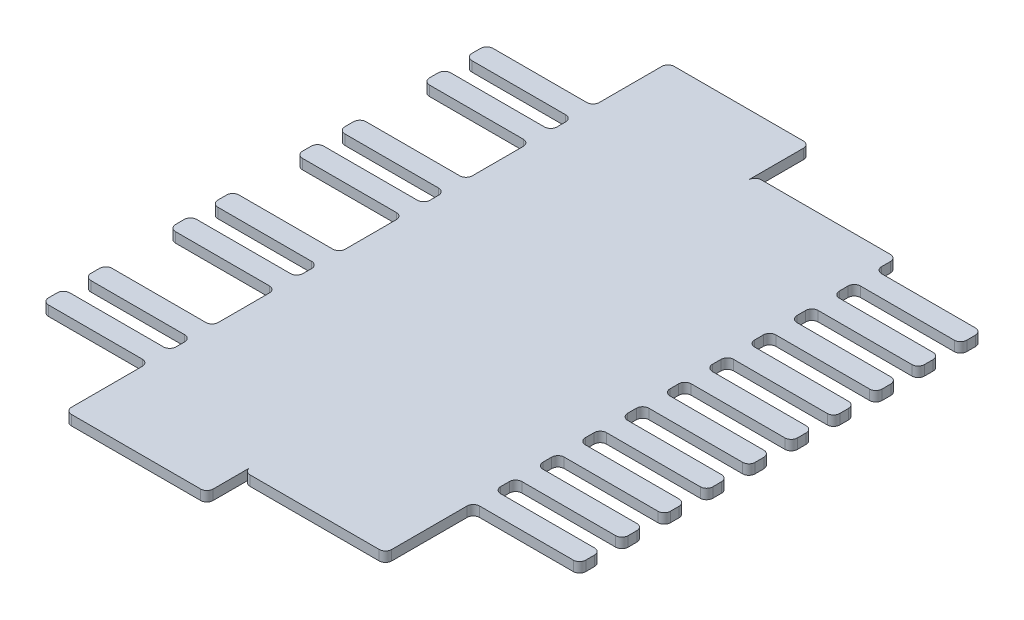
from build123d import *

# Parameters (mm, degrees)
BOSS_EXTRUDE1_DEPTH = 1.2


with BuildPart() as part:
    # Sketch1 → Boss-Extrude1 (new body)
    with BuildSketch(Plane(origin=(0, 0, 0), x_dir=(1, 0, 0), z_dir=(0, 1, 0))):
        with BuildLine():
            Line((-0.75, 10), (-12, 10))
            ThreePointArc((-12, 10), (-12.530330086, 10.219669914), (-12.75, 10.75))
            Line((-12.75, 10.75), (-12.75, 11.79))
            ThreePointArc((-12.75, 11.79), (-12.530330086, 12.320330086), (-12, 12.54))
            Line((-12, 12.54), (-0.75, 12.54))
            ThreePointArc((-0.75, 12.54), (-0.219669914, 12.759669914), (0, 13.29))
            Line((0, 13.29), (0, 14.33))
            ThreePointArc((0, 14.33), (-0.219669914, 14.860330086), (-0.75, 15.08))
            Line((-0.75, 15.08), (-12, 15.08))
            ThreePointArc((-12, 15.08), (-12.530330086, 15.299669914), (-12.75, 15.83))
            Line((-12.75, 15.83), (-12.75, 16.87))
            ThreePointArc((-12.75, 16.87), (-12.530330086, 17.400330086), (-12, 17.62))
            Line((-12, 17.62), (-0.75, 17.62))
            ThreePointArc((-0.75, 17.62), (-0.219669914, 17.839669914), (0, 18.37))
            Line((0, 18.37), (0, 24.49))
            ThreePointArc((0, 24.49), (-0.219669914, 25.020330086), (-0.75, 25.24))
            Line((-0.75, 25.24), (-12, 25.24))
            ThreePointArc((-12, 25.24), (-12.530330086, 25.459669914), (-12.75, 25.99))
            Line((-12.75, 25.99), (-12.75, 27.03))
            ThreePointArc((-12.75, 27.03), (-12.530330086, 27.560330086), (-12, 27.78))
            Line((-12, 27.78), (-0.75, 27.78))
            ThreePointArc((-0.75, 27.78), (-0.219669914, 27.999669914), (0, 28.53))
            Line((0, 28.53), (0, 29.57))
            ThreePointArc((0, 29.57), (-0.219669914, 30.100330086), (-0.75, 30.32))
            Line((-0.75, 30.32), (-12, 30.32))
            ThreePointArc((-12, 30.32), (-12.530330086, 30.539669914), (-12.75, 31.07))
            Line((-12.75, 31.07), (-12.75, 32.11))
            ThreePointArc((-12.75, 32.11), (-12.530330086, 32.640330086), (-12, 32.86))
            Line((-12, 32.86), (-0.75, 32.86))
            ThreePointArc((-0.75, 32.86), (-0.219669914, 33.079669914), (0, 33.61))
            Line((0, 33.61), (0, 39.73))
            ThreePointArc((0, 39.73), (-0.219669914, 40.260330086), (-0.75, 40.48))
            Line((-0.75, 40.48), (-12, 40.48))
            ThreePointArc((-12, 40.48), (-12.530330086, 40.699669914), (-12.75, 41.23))
            Line((-12.75, 41.23), (-12.75, 42.27))
            ThreePointArc((-12.75, 42.27), (-12.530330086, 42.800330086), (-12, 43.02))
            Line((-12, 43.02), (-0.75, 43.02))
            ThreePointArc((-0.75, 43.02), (-0.219669914, 43.239669914), (0, 43.77))
            Line((0, 43.77), (0, 44.81))
            ThreePointArc((0, 44.81), (-0.219669914, 45.340330086), (-0.75, 45.56))
            Line((-0.75, 45.56), (-12, 45.56))
            ThreePointArc((-12, 45.56), (-12.530330086, 45.779669914), (-12.75, 46.31))
            Line((-12.75, 46.31), (-12.75, 47.35))
            ThreePointArc((-12.75, 47.35), (-12.530330086, 47.880330086), (-12, 48.1))
            Line((-12, 48.1), (-0.75, 48.1))
            ThreePointArc((-0.75, 48.1), (-0.219669914, 48.319669914), (0, 48.85))
            Line((0, 48.85), (0, 54.97))
            ThreePointArc((0, 54.97), (-0.219669914, 55.500330086), (-0.75, 55.72))
            Line((-0.75, 55.72), (-12, 55.72))
            ThreePointArc((-12, 55.72), (-12.530330086, 55.939669914), (-12.75, 56.47))
            Line((-12.75, 56.47), (-12.75, 57.51))
            ThreePointArc((-12.75, 57.51), (-12.530330086, 58.040330086), (-12, 58.26))
            Line((-12, 58.26), (-0.75, 58.26))
            ThreePointArc((-0.75, 58.26), (-0.219669914, 58.479669914), (0, 59.01))
            Line((0, 59.01), (0, 60.05))
            ThreePointArc((0, 60.05), (-0.219669914, 60.580330086), (-0.75, 60.8))
            Line((-0.75, 60.8), (-12, 60.8))
            ThreePointArc((-12, 60.8), (-12.530330086, 61.019669914), (-12.75, 61.55))
            Line((-12.75, 61.55), (-12.75, 62.59))
            ThreePointArc((-12.75, 62.59), (-12.530330086, 63.120330086), (-12, 63.34))
            Line((-12, 63.34), (-0.75, 63.34))
            ThreePointArc((-0.75, 63.34), (-0.219669914, 63.559669914), (0, 64.09))
            Line((0, 64.09), (0, 71.59))
            ThreePointArc((0, 71.59), (0.219669914, 72.120330086), (0.75, 72.34))
            Line((0.75, 72.34), (16.25, 72.34))
            ThreePointArc((16.25, 72.34), (16.780330086, 72.120330086), (17, 71.59))
            Line((17, 71.59), (17, 65.023006715))
            ThreePointArc((17, 65.023006715), (17.219669914, 65.553336801), (17.75, 65.773006715))
            Line((17.75, 65.773006715), (33.25, 65.773006715))
            ThreePointArc((33.25, 65.773006715), (33.780330086, 65.553336801), (34, 65.023006715))
            Line((34, 65.023006715), (34, 63.983006715))
            ThreePointArc((34, 63.983006715), (34.219669914, 63.452676629), (34.75, 63.233006715))
            Line((34.75, 63.233006715), (46, 63.233006715))
            ThreePointArc((46, 63.233006715), (46.530330086, 63.013336801), (46.75, 62.483006715))
            Line((46.75, 62.483006715), (46.75, 61.443006715))
            ThreePointArc((46.75, 61.443006715), (46.530330086, 60.912676629), (46, 60.693006715))
            Line((46, 60.693006715), (34.75, 60.693006715))
            ThreePointArc((34.75, 60.693006715), (34.219669914, 60.473336801), (34, 59.943006715))
            Line((34, 59.943006715), (34, 58.903006715))
            ThreePointArc((34, 58.903006715), (34.219669914, 58.372676629), (34.75, 58.153006715))
            Line((34.75, 58.153006715), (46, 58.153006715))
            ThreePointArc((46, 58.153006715), (46.530330086, 57.933336801), (46.75, 57.403006715))
            Line((46.75, 57.403006715), (46.75, 56.363006715))
            ThreePointArc((46.75, 56.363006715), (46.530330086, 55.832676629), (46, 55.613006715))
            Line((46, 55.613006715), (34.75, 55.613006715))
            ThreePointArc((34.75, 55.613006715), (34.219669914, 55.393336801), (34, 54.863006715))
            Line((34, 54.863006715), (34, 53.823006715))
            ThreePointArc((34, 53.823006715), (34.219669914, 53.292676629), (34.75, 53.073006715))
            Line((34.75, 53.073006715), (46, 53.073006715))
            ThreePointArc((46, 53.073006715), (46.530330086, 52.853336801), (46.75, 52.323006715))
            Line((46.75, 52.323006715), (46.75, 51.283006715))
            ThreePointArc((46.75, 51.283006715), (46.530330086, 50.752676629), (46, 50.533006715))
            Line((46, 50.533006715), (34.75, 50.533006715))
            ThreePointArc((34.75, 50.533006715), (34.219669914, 50.313336801), (34, 49.783006715))
            Line((34, 49.783006715), (34, 48.743006715))
            ThreePointArc((34, 48.743006715), (34.219669914, 48.212676629), (34.75, 47.993006715))
            Line((34.75, 47.993006715), (46, 47.993006715))
            ThreePointArc((46, 47.993006715), (46.530330086, 47.773336801), (46.75, 47.243006715))
            Line((46.75, 47.243006715), (46.75, 46.203006715))
            ThreePointArc((46.75, 46.203006715), (46.530330086, 45.672676629), (46, 45.453006715))
            Line((46, 45.453006715), (34.75, 45.453006715))
            ThreePointArc((34.75, 45.453006715), (34.219669914, 45.233336801), (34, 44.703006715))
            Line((34, 44.703006715), (34, 43.663006715))
            ThreePointArc((34, 43.663006715), (34.219669914, 43.132676629), (34.75, 42.913006715))
            Line((34.75, 42.913006715), (46, 42.913006715))
            ThreePointArc((46, 42.913006715), (46.530330086, 42.693336801), (46.75, 42.163006715))
            Line((46.75, 42.163006715), (46.75, 41.123006715))
            ThreePointArc((46.75, 41.123006715), (46.530330086, 40.592676629), (46, 40.373006715))
            Line((46, 40.373006715), (34.75, 40.373006715))
            ThreePointArc((34.75, 40.373006715), (34.219669914, 40.153336801), (34, 39.623006715))
            Line((34, 39.623006715), (34, 38.583006715))
            ThreePointArc((34, 38.583006715), (34.219669914, 38.052676629), (34.75, 37.833006715))
            Line((34.75, 37.833006715), (46, 37.833006715))
            ThreePointArc((46, 37.833006715), (46.530330086, 37.613336801), (46.75, 37.083006715))
            Line((46.75, 37.083006715), (46.75, 36.043006715))
            ThreePointArc((46.75, 36.043006715), (46.530330086, 35.512676629), (46, 35.293006715))
            Line((46, 35.293006715), (34.75, 35.293006715))
            ThreePointArc((34.75, 35.293006715), (34.219669914, 35.073336801), (34, 34.543006715))
            Line((34, 34.543006715), (34, 33.503006715))
            ThreePointArc((34, 33.503006715), (34.219669914, 32.972676629), (34.75, 32.753006715))
            Line((34.75, 32.753006715), (46, 32.753006715))
            ThreePointArc((46, 32.753006715), (46.530330086, 32.533336801), (46.75, 32.003006715))
            Line((46.75, 32.003006715), (46.75, 30.963006715))
            ThreePointArc((46.75, 30.963006715), (46.530330086, 30.432676629), (46, 30.213006715))
            Line((46, 30.213006715), (34.75, 30.213006715))
            ThreePointArc((34.75, 30.213006715), (34.219669914, 29.993336801), (34, 29.463006715))
            Line((34, 29.463006715), (34, 28.423006715))
            ThreePointArc((34, 28.423006715), (34.219669914, 27.892676629), (34.75, 27.673006715))
            Line((34.75, 27.673006715), (46, 27.673006715))
            ThreePointArc((46, 27.673006715), (46.530330086, 27.453336801), (46.75, 26.923006715))
            Line((46.75, 26.923006715), (46.75, 25.883006715))
            ThreePointArc((46.75, 25.883006715), (46.530330086, 25.352676629), (46, 25.133006715))
            Line((46, 25.133006715), (34.75, 25.133006715))
            ThreePointArc((34.75, 25.133006715), (34.219669914, 24.913336801), (34, 24.383006715))
            Line((34, 24.383006715), (34, 23.343006715))
            ThreePointArc((34, 23.343006715), (34.219669914, 22.812676629), (34.75, 22.593006715))
            Line((34.75, 22.593006715), (46, 22.593006715))
            ThreePointArc((46, 22.593006715), (46.530330086, 22.373336801), (46.75, 21.843006715))
            Line((46.75, 21.843006715), (46.75, 20.803006715))
            ThreePointArc((46.75, 20.803006715), (46.530330086, 20.272676629), (46, 20.053006715))
            Line((46, 20.053006715), (34.75, 20.053006715))
            ThreePointArc((34.75, 20.053006715), (34.219669914, 19.833336801), (34, 19.303006715))
            Line((34, 19.303006715), (34, 18.263006715))
            ThreePointArc((34, 18.263006715), (34.219669914, 17.732676629), (34.75, 17.513006715))
            Line((34.75, 17.513006715), (46, 17.513006715))
            ThreePointArc((46, 17.513006715), (46.530330086, 17.293336801), (46.75, 16.763006715))
            Line((46.75, 16.763006715), (46.75, 15.723006715))
            ThreePointArc((46.75, 15.723006715), (46.530330086, 15.192676629), (46, 14.973006715))
            Line((46, 14.973006715), (34.75, 14.973006715))
            ThreePointArc((34.75, 14.973006715), (34.219669914, 14.753336801), (34, 14.223006715))
            Line((34, 14.223006715), (34, 5.183006715))
            ThreePointArc((34, 5.183006715), (33.780330086, 4.652676629), (33.25, 4.433006715))
            Line((33.25, 4.433006715), (17.75, 4.433006715))
            ThreePointArc((17.75, 4.433006715), (17.219669914, 4.652676629), (17, 5.183006715))
            Line((17, 5.183006715), (17, 0.75))
            ThreePointArc((17, 0.75), (16.780330086, 0.219669914), (16.25, 0))
            Line((16.25, 0), (0.75, 0))
            ThreePointArc((0.75, 0), (0.219669914, 0.219669914), (0, 0.75))
            Line((0, 0.75), (0, 9.25))
            ThreePointArc((0, 9.25), (-0.219669914, 9.780330086), (-0.75, 10))
        make_face()
    extrude(amount=BOSS_EXTRUDE1_DEPTH)


solid = part.part
